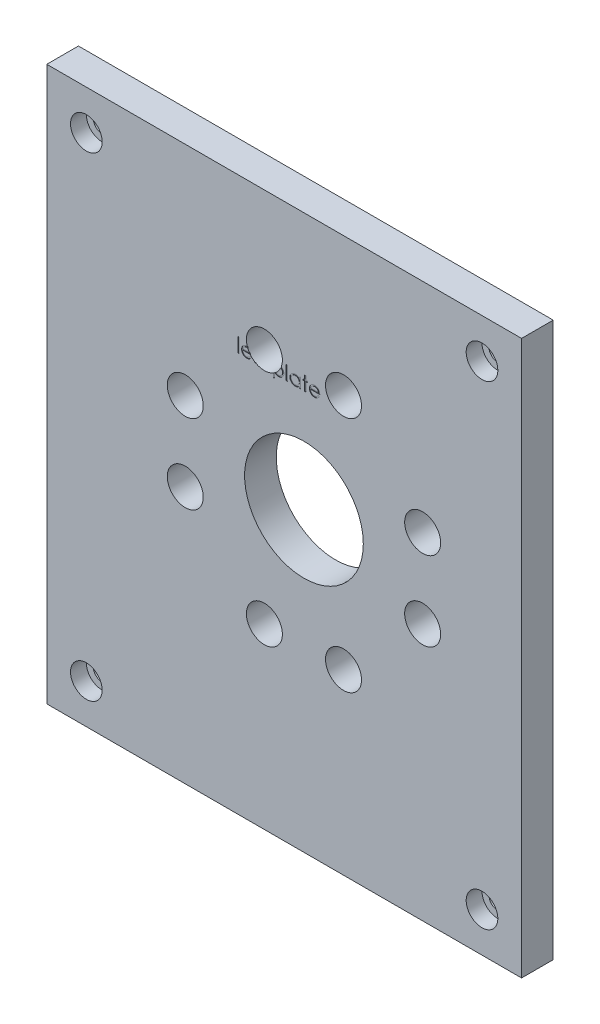
from build123d import *

# Parameters (mm, degrees)
SKETCH_1_W                   = 120
SKETCH_1_H                   = 140
EXTRUDE_1_DEPTH              = 8
HOLE_WIZARD_M4_1_D           = 4.5
HOLE_WIZARD_M4_1_CBORE_D     = 8
HOLE_WIZARD_M4_1_CBORE_DEPTH = 4
SKETCH_4_W                   = 0.314102564
SKETCH_4_H                   = 3.58974359
SKETCH_4_W_2                 = 1.346153846
SKETCH_4_H_2                 = 0.358974359
CUT_EXTRUDE_1_DEPTH          = 0.1
SKETCH_5_R                   = 15
CUT_EXTRUDE_2_DEPTH          = 93.541882551
SKETCH_6_R                   = 4.55
CUT_EXTRUDE_3_DEPTH          = 93.541882551
PATTERN_CIRCULAR_1_COUNT     = 4


with BuildPart() as part:
    # 스케치1 → 보스-돌출1 (new body)
    with BuildSketch(Plane.XY):
        Rectangle(SKETCH_1_W, SKETCH_1_H)
    extrude(amount=EXTRUDE_1_DEPTH)

    # M4 소켓 머리 캡 나사용 카운터보어1 (through all)
    with Locations(Plane.XY.offset(8)):
        with Locations((-50, 60), (50, 60), (50, -60), (-50, -60)):
            CounterBoreHole(HOLE_WIZARD_M4_1_D / 2, HOLE_WIZARD_M4_1_CBORE_D / 2, HOLE_WIZARD_M4_1_CBORE_DEPTH)

    # 스케치4 → 컷-돌출1 (cut)
    # profile 1 of 10: a face of its own
    with BuildSketch(Plane.XY.offset(8)):
        with Locations((-11.532382197, 32.791146705)):
            Rectangle(SKETCH_4_W, SKETCH_4_H)
    # profile 2 of 10: a face of its own
    with BuildSketch(Plane.XY.offset(8)):
        with BuildLine():
            Line((-8.558223543, 31.803967217), (-8.279177069, 31.657432762))
            add(Edge.make_bspline(
                [(-8.279177069, 31.657432762), (-8.301413664, 31.617989431), (-8.344677272, 31.541248328), (-8.41907802, 31.435816468), (-8.497070093, 31.340968752), (-8.582174061, 31.259239098), (-8.67184374, 31.187987713), (-8.766576395, 31.125649888), (-8.866865212, 31.072531368), (-8.972714937, 31.02777884), (-9.085014488, 30.993369346), (-9.204036005, 30.969065125), (-9.3300075, 30.954041856), (-9.41635368, 30.952296715), (-9.460567293, 30.951403115)],
                knots=[0, 0, 0, 0, 1.120438281, 2.179929193, 3.190490725, 4.156257408, 5.095198341, 6.022838206, 6.959905092, 7.901321166, 8.864066838, 9.862729781, 10.905609505, 12, 12, 12, 12], degree=3))
            add(Edge.make_bspline(
                [(-9.460567293, 30.951403115), (-9.509709271, 30.95255029), (-9.605571032, 30.954788097), (-9.745110779, 30.974080561), (-9.876490198, 31.00555292), (-9.999701901, 31.049518462), (-10.114444154, 31.106945786), (-10.220945009, 31.176905267), (-10.319764534, 31.259037522), (-10.407788744, 31.354053966), (-10.487032626, 31.455735923), (-10.556958446, 31.561691807), (-10.615415877, 31.671655032), (-10.662968488, 31.784925556), (-10.701373352, 31.900789449), (-10.728140056, 32.020300917), (-10.743569804, 32.143136501), (-10.74593425, 32.226233837), (-10.747125787, 32.268109846)],
                knots=[0, 0, 0, 0, 1.145258523, 2.234067595, 3.276747158, 4.290159414, 5.277019952, 6.260822364, 7.254936242, 8.264827045, 9.274100331, 10.257902744, 11.220704747, 12.172965371, 13.118907548, 14.062713208, 15.023725156, 16, 16, 16, 16], degree=3))
            add(Edge.make_bspline(
                [(-10.747125787, 32.268109846), (-10.746066645, 32.307404676), (-10.743967567, 32.385281841), (-10.73073678, 32.500547385), (-10.707288487, 32.612575838), (-10.675112163, 32.721460286), (-10.633560917, 32.82701842), (-10.582728697, 32.929314483), (-10.52253632, 33.028239623), (-10.476063646, 33.090642757), (-10.452654633, 33.122076192)],
                knots=[0, 0, 0, 0, 1.024358464, 2.0301432, 3.019427413, 4.004406732, 4.986367066, 5.972626655, 6.978780325, 8, 8, 8, 8], degree=3))
            add(Edge.make_bspline(
                [(-10.452654633, 33.122076192), (-10.42094695, 33.159945062), (-10.358536003, 33.234483212), (-10.252979648, 33.332421538), (-10.138679452, 33.414465313), (-10.017067826, 33.482472449), (-9.886731352, 33.534146096), (-9.749422061, 33.572653679), (-9.603576474, 33.59423169), (-9.503871253, 33.597279523), (-9.452854953, 33.598839012)],
                knots=[0, 0, 0, 0, 1.030682036, 2.02871468, 2.997146059, 3.962720338, 4.930598197, 5.918074684, 6.934738563, 8, 8, 8, 8], degree=3))
            add(Edge.make_bspline(
                [(-9.452854953, 33.598839012), (-9.400407348, 33.597484963), (-9.297517102, 33.594828628), (-9.147484981, 33.570202295), (-9.005524265, 33.53114974), (-8.87169176, 33.47599595), (-8.745973899, 33.404836398), (-8.62918785, 33.316694556), (-8.519336337, 33.214276469), (-8.455427758, 33.13551326), (-8.422907037, 33.095433564)],
                knots=[0, 0, 0, 0, 1.056321875, 2.072262726, 3.055038591, 4.01806755, 4.982017516, 5.957941055, 6.960871419, 8, 8, 8, 8], degree=3))
            add(Edge.make_bspline(
                [(-8.422907037, 33.095433564), (-8.400780098, 33.065229982), (-8.356673505, 33.005023864), (-8.301426405, 32.906852706), (-8.25346901, 32.804142112), (-8.215136049, 32.695231815), (-8.184096548, 32.581412235), (-8.161639729, 32.46186969), (-8.148470111, 32.336639779), (-8.145881413, 32.251313223), (-8.144561684, 32.207813371)],
                knots=[0, 0, 0, 0, 0.94817472, 1.890038105, 2.849395472, 3.817997239, 4.812318967, 5.836947057, 6.897266129, 8, 8, 8, 8], degree=3))
            Line((-8.144561684, 32.207813371), (-10.433023223, 32.207813371))
            add(Edge.make_bspline(
                [(-10.433023223, 32.207813371), (-10.431483616, 32.174112907), (-10.428456042, 32.107842303), (-10.414340899, 32.01087152), (-10.392092125, 31.918498178), (-10.360823063, 31.831415136), (-10.322956217, 31.748485009), (-10.276570501, 31.670322972), (-10.221230947, 31.597285042), (-10.159505247, 31.528717904), (-10.090798152, 31.467657143), (-10.018515405, 31.413005367), (-9.94162184, 31.36719977), (-9.860723756, 31.33001988), (-9.775951971, 31.300913564), (-9.687279776, 31.281045743), (-9.59488166, 31.267738636), (-9.531895926, 31.266258971), (-9.499830114, 31.265505679)],
                knots=[0, 0, 0, 0, 1.094153842, 2.151609401, 3.174256925, 4.172055639, 5.149267565, 6.128595816, 7.11444997, 8.118368179, 9.117203808, 10.09244225, 11.054858984, 12.015122123, 12.976791628, 13.957293641, 14.960065497, 16, 16, 16, 16], degree=3))
            add(Edge.make_bspline(
                [(-9.499830114, 31.265505679), (-9.468478966, 31.266113736), (-9.406272275, 31.267320237), (-9.313631418, 31.279052148), (-9.22249189, 31.298022423), (-9.133230907, 31.323912413), (-9.047660061, 31.355489265), (-8.968414511, 31.393592123), (-8.895534295, 31.43574187), (-8.827417329, 31.483951545), (-8.761346336, 31.542959732), (-8.695803849, 31.616595453), (-8.625527196, 31.703682981), (-8.581537603, 31.769228647), (-8.558223543, 31.803967217)],
                knots=[0, 0, 0, 0, 0.99110716, 1.966546729, 2.947904876, 3.932708344, 4.903319531, 5.828989031, 6.710028674, 7.56322171, 8.463672341, 9.504779593, 10.677557249, 12, 12, 12, 12], degree=3))
        make_face()
        with BuildLine():
            add(Edge.make_bspline(
                [(-8.458664248, 32.521915935), (-8.470160873, 32.563578809), (-8.492288174, 32.64376643), (-8.538524539, 32.75480732), (-8.590596079, 32.853495221), (-8.652217811, 32.939074854), (-8.722036536, 33.015078367), (-8.802681719, 33.081496952), (-8.893117613, 33.140914403), (-8.992876753, 33.191066903), (-9.098518538, 33.233756762), (-9.20912473, 33.262381877), (-9.321982518, 33.28199142), (-9.398316804, 33.283817528), (-9.436729152, 33.284736448)],
                knots=[0, 0, 0, 0, 1.154881502, 2.222775134, 3.210006277, 4.132804581, 5.035138423, 5.962687519, 6.919655026, 7.923214229, 8.944639381, 9.960483929, 10.97369054, 12, 12, 12, 12], degree=3))
            add(Edge.make_bspline(
                [(-9.436729152, 33.284736448), (-9.468078591, 33.284124777), (-9.53004984, 33.282915631), (-9.621350908, 33.271445501), (-9.709030607, 33.252485656), (-9.793735894, 33.2265207), (-9.874356763, 33.191912097), (-9.952551531, 33.151328871), (-10.026331927, 33.101787287), (-10.072473223, 33.064028432), (-10.095783639, 33.044952794)],
                knots=[0, 0, 0, 0, 1.04873581, 2.073130211, 3.073294108, 4.04793562, 5.032784715, 6.005352987, 6.992311501, 8, 8, 8, 8], degree=3))
            add(Edge.make_bspline(
                [(-10.095783639, 33.044952794), (-10.112476921, 33.029858479), (-10.146260055, 32.999311263), (-10.191400577, 32.946682056), (-10.23462105, 32.889930494), (-10.273954702, 32.826885369), (-10.310032289, 32.75826459), (-10.343792266, 32.684646955), (-10.374178678, 32.605473825), (-10.391274788, 32.550301386), (-10.400070498, 32.521915935)],
                knots=[0, 0, 0, 0, 0.879870761, 1.780643979, 2.707998968, 3.669668524, 4.684282772, 5.740141944, 6.837334558, 8, 8, 8, 8], degree=3))
            Line((-10.400070498, 32.521915935), (-8.458664248, 32.521915935))
        make_face(mode=Mode.SUBTRACT)
    # profile 3 of 10: a face of its own
    with BuildSketch(Plane.XY.offset(8)):
        with BuildLine():
            Line((-6.439433479, 34.564984846), (-6.439433479, 34.238262089))
            add(Edge.make_bspline(
                [(-6.439433479, 34.238262089), (-6.469172258, 34.250212962), (-6.525617079, 34.272895965), (-6.608857455, 34.297560591), (-6.685386289, 34.313496331), (-6.734540179, 34.315732275), (-6.757742774, 34.31678773)],
                knots=[0, 0, 0, 0, 1.16548392, 2.212112691, 3.15604595, 4, 4, 4, 4], degree=3))
            add(Edge.make_bspline(
                [(-6.757742774, 34.31678773), (-6.773416538, 34.31613639), (-6.803755717, 34.314875613), (-6.847359044, 34.308447337), (-6.886648254, 34.295344536), (-6.921553874, 34.27831526), (-6.950504334, 34.256961076), (-6.975290558, 34.235505812), (-6.993257088, 34.211320631), (-7.003012036, 34.188800221), (-7.008962036, 34.167949228), (-7.010752165, 34.146594962), (-7.015137079, 34.120370875), (-7.016359885, 34.088207157), (-7.019147254, 34.051104447), (-7.018900613, 34.00827755), (-7.021184536, 33.960400408), (-7.020842621, 33.926499859), (-7.020663447, 33.908734846)],
                knots=[0, 0, 0, 0, 1.311993654, 2.539582093, 3.670788641, 4.763509788, 5.772417512, 6.671800701, 7.496729179, 8.266799162, 8.712543678, 9.304149002, 10.05334463, 10.934920737, 11.99209668, 13.165090968, 14.514413552, 16, 16, 16, 16], degree=3))
            Line((-7.020663447, 33.908734846), (-7.020663447, 33.553967217))
            Line((-7.020663447, 33.553967217), (-6.484305274, 33.553967217))
            Line((-6.484305274, 33.553967217), (-6.484305274, 33.239864653))
            Line((-6.484305274, 33.239864653), (-7.021364569, 33.239864653))
            Line((-7.021364569, 33.239864653), (-7.022766812, 30.99627491))
            Line((-7.022766812, 30.99627491), (-7.336869376, 30.99627491))
            Line((-7.336869376, 30.99627491), (-7.336869376, 33.239864653))
            Line((-7.336869376, 33.239864653), (-7.695843735, 33.239864653))
            Line((-7.695843735, 33.239864653), (-7.695843735, 33.553967217))
            Line((-7.695843735, 33.553967217), (-7.336869376, 33.553967217))
            Line((-7.336869376, 33.553967217), (-7.336869376, 33.962721224))
            add(Edge.make_bspline(
                [(-7.336869376, 33.962721224), (-7.336844162, 33.985396804), (-7.336795791, 34.028897708), (-7.33340794, 34.091507148), (-7.330512219, 34.149330613), (-7.324744591, 34.201919245), (-7.318082886, 34.249765389), (-7.308546726, 34.29215827), (-7.299535355, 34.330240029), (-7.283186763, 34.373342686), (-7.258764544, 34.42219271), (-7.219234347, 34.47381661), (-7.17184134, 34.520121557), (-7.115233016, 34.55912891), (-7.051517481, 34.591544388), (-6.980636303, 34.614786241), (-6.903361105, 34.627926685), (-6.849873635, 34.629880895), (-6.822245979, 34.630890294)],
                knots=[0, 0, 0, 0, 1.116398763, 2.141702935, 3.087165306, 3.966655413, 4.746276475, 5.464069668, 6.106083417, 6.67047701, 7.730773247, 8.782666744, 9.856985883, 10.980834087, 12.154321827, 13.366232824, 14.639591414, 16, 16, 16, 16], degree=3))
            add(Edge.make_bspline(
                [(-6.822245979, 34.630890294), (-6.794169221, 34.629932914), (-6.735223556, 34.627922944), (-6.643026954, 34.615489537), (-6.543430436, 34.594018507), (-6.475094516, 34.574940622), (-6.439433479, 34.564984846)],
                knots=[0, 0, 0, 0, 0.864728408, 1.815451418, 2.859995356, 4, 4, 4, 4], degree=3))
        make_face()
    # profile 4 of 10: a face of its own
    with BuildSketch(Plane.XY.offset(8)):
        Polygon((-5.676612966, 34.5860185), (-5.362510402, 34.5860185), (-5.362510402, 33.553967217), (-4.913792453, 33.553967217), (-4.913792453, 33.239864653), (-5.362510402, 33.239864653), (-5.362510402, 30.99627491), (-5.676612966, 30.99627491), (-5.676612966, 33.239864653), (-6.125330915, 33.239864653), (-6.125330915, 33.553967217), (-5.676612966, 33.553967217), align=None)
    # profile 5 of 10: a face of its own
    with BuildSketch(Plane.XY.offset(8)):
        with Locations((-3.926612966, 32.342428756)):
            Rectangle(SKETCH_4_W_2, SKETCH_4_H_2)
    # profile 6 of 10: a face of its own
    with BuildSketch(Plane.XY.offset(8)):
        with BuildLine():
            Line((-2.7599463, 33.553967217), (-2.445843735, 33.553967217))
            Line((-2.445843735, 33.553967217), (-2.445843735, 33.080710006))
            add(Edge.make_bspline(
                [(-2.445843735, 33.080710006), (-2.412486251, 33.12364774), (-2.347662657, 33.207088633), (-2.235937752, 33.315078761), (-2.118010943, 33.406154065), (-1.99084753, 33.477536598), (-1.85642384, 33.53135741), (-1.715291523, 33.57113686), (-1.566252758, 33.594578334), (-1.464356305, 33.597399995), (-1.41239021, 33.598839012)],
                knots=[0, 0, 0, 0, 1.0828784, 2.104357462, 3.088488658, 4.04616522, 5.001424249, 5.969181776, 6.964304535, 8, 8, 8, 8], degree=3))
            add(Edge.make_bspline(
                [(-1.41239021, 33.598839012), (-1.366998607, 33.597525833), (-1.277279718, 33.594930266), (-1.145216489, 33.577357212), (-1.018041106, 33.547239519), (-0.896473052, 33.503838604), (-0.779209987, 33.450183134), (-0.667987887, 33.382466099), (-0.561074331, 33.304059908), (-0.461158142, 33.213827757), (-0.368836775, 33.11619949), (-0.288990593, 33.011177186), (-0.220118689, 32.9022146), (-0.164448393, 32.787622508), (-0.120840045, 32.668303278), (-0.089825368, 32.543774837), (-0.071367724, 32.414498897), (-0.068891272, 32.326596176), (-0.067638607, 32.282132282)],
                knots=[0, 0, 0, 0, 1.041296284, 2.058176809, 3.050446431, 4.034000596, 5.01514041, 6.003636468, 7.015969324, 8.052561599, 9.08815499, 10.094063707, 11.074456064, 12.040834395, 13.011057502, 13.983766392, 14.980127149, 16, 16, 16, 16], degree=3))
            add(Edge.make_bspline(
                [(-0.067638607, 32.282132282), (-0.068864093, 32.236729973), (-0.071280927, 32.147190069), (-0.090025933, 32.015702971), (-0.119982807, 31.889215597), (-0.16304099, 31.767938334), (-0.218682479, 31.651954683), (-0.286387039, 31.541348287), (-0.366273506, 31.436154583), (-0.457574634, 31.337801683), (-0.55662757, 31.24720237), (-0.662505059, 31.167964301), (-0.773563985, 31.101422926), (-0.889236152, 31.045839966), (-1.010511791, 31.003947782), (-1.136825068, 30.973729981), (-1.268107215, 30.955095486), (-1.357408367, 30.952643343), (-1.402574505, 30.951403115)],
                knots=[0, 0, 0, 0, 1.038740735, 2.04854663, 3.033179607, 4.009277356, 4.987731542, 5.972001279, 6.972200261, 8.005528982, 9.039189865, 10.040446548, 11.026516639, 11.997840187, 12.972163198, 13.956796175, 14.96660207, 16, 16, 16, 16], degree=3))
            add(Edge.make_bspline(
                [(-1.402574505, 30.951403115), (-1.453402077, 30.952697923), (-1.553801433, 30.955255547), (-1.700599103, 30.981174958), (-1.841875955, 31.019911893), (-1.97606678, 31.076610887), (-2.104234592, 31.148866403), (-2.225654398, 31.236976609), (-2.340971151, 31.340757233), (-2.410379908, 31.41948905), (-2.445843735, 31.459716416)],
                knots=[0, 0, 0, 0, 1.014726462, 2.004382257, 2.969841629, 3.936926163, 4.907207904, 5.903978561, 6.929055279, 8, 8, 8, 8], degree=3))
            Line((-2.445843735, 31.459716416), (-2.445843735, 30.053967217))
            Line((-2.445843735, 30.053967217), (-2.7599463, 30.053967217))
            Line((-2.7599463, 30.053967217), (-2.7599463, 33.553967217))
        make_face()
        with BuildLine():
            add(Edge.make_bspline(
                [(-1.415194697, 33.284736448), (-1.450774259, 33.28409619), (-1.520821247, 33.282835687), (-1.623493466, 33.267861738), (-1.722388894, 33.246123997), (-1.816510845, 33.213212096), (-1.906761462, 33.172813283), (-1.992445627, 33.122331272), (-2.073503194, 33.062679266), (-2.149730225, 32.994999922), (-2.218593518, 32.920425234), (-2.279556446, 32.840837425), (-2.330763751, 32.756337285), (-2.373265771, 32.667711923), (-2.405609054, 32.574266638), (-2.428564774, 32.476533625), (-2.442995127, 32.374405913), (-2.444884064, 32.304849906), (-2.445843735, 32.269512089)],
                knots=[0, 0, 0, 0, 1.05670511, 2.080379991, 3.077984906, 4.06214886, 5.038337365, 6.01289324, 7.01187578, 8.025460281, 9.038092164, 10.024533457, 11.000252242, 11.969694649, 12.940728589, 13.933144304, 14.949937299, 16, 16, 16, 16], degree=3))
            add(Edge.make_bspline(
                [(-2.445843735, 32.269512089), (-2.444252879, 32.223123977), (-2.441136257, 32.132245736), (-2.415798889, 31.999461614), (-2.374563625, 31.873809958), (-2.316034912, 31.756348921), (-2.242087338, 31.648366086), (-2.152989181, 31.551675479), (-2.04954663, 31.466884888), (-1.933479438, 31.395463635), (-1.809057308, 31.337475568), (-1.679271396, 31.295961358), (-1.545906515, 31.27038913), (-1.455738195, 31.267142311), (-1.410286844, 31.265505679)],
                knots=[0, 0, 0, 0, 1.03728447, 2.032128127, 3.01272805, 3.987917167, 4.958271349, 5.931593992, 6.91984656, 7.941419022, 8.973179163, 9.983609215, 10.983593296, 12, 12, 12, 12], degree=3))
            add(Edge.make_bspline(
                [(-1.410286844, 31.265505679), (-1.365751076, 31.267062056), (-1.277355583, 31.270151184), (-1.147197462, 31.296889372), (-1.020706824, 31.337734396), (-0.900526651, 31.397293953), (-0.787703163, 31.470284011), (-0.68582161, 31.557844044), (-0.596814696, 31.659333987), (-0.520950341, 31.77234249), (-0.459818856, 31.893517874), (-0.413888616, 32.018899262), (-0.387380043, 32.148044685), (-0.383623254, 32.235042398), (-0.381741171, 32.278626673)],
                knots=[0, 0, 0, 0, 1.00104056, 1.986885549, 2.97790532, 3.984399681, 4.995088187, 5.994304198, 6.996462723, 8.023150851, 9.048424203, 10.043036403, 11.019596776, 12, 12, 12, 12], degree=3))
            add(Edge.make_bspline(
                [(-0.381741171, 32.278626673), (-0.383195905, 32.322481662), (-0.386094039, 32.409849965), (-0.414641077, 32.538612868), (-0.457541054, 32.664500844), (-0.520100106, 32.784021394), (-0.594301376, 32.896795477), (-0.684048373, 32.996349356), (-0.784664569, 33.083520029), (-0.897353733, 33.155535438), (-1.018294159, 33.212820933), (-1.145609075, 33.254704572), (-1.278652677, 33.279878322), (-1.369280331, 33.283102828), (-1.415194697, 33.284736448)],
                knots=[0, 0, 0, 0, 0.983928682, 1.960191568, 2.949917689, 3.96440592, 4.982380491, 5.975291189, 6.965713506, 7.964880129, 8.970154049, 9.96478489, 10.968906225, 12, 12, 12, 12], degree=3))
        make_face(mode=Mode.SUBTRACT)
    # profile 7 of 10: a face of its own
    with BuildSketch(Plane.XY.offset(8)):
        with Locations((0.672746008, 32.791146705)):
            Rectangle(SKETCH_4_W, SKETCH_4_H)
    # profile 8 of 10: a face of its own
    with BuildSketch(Plane.XY.offset(8)):
        with BuildLine():
            Line((4.150310111, 33.553967217), (4.150310111, 30.99627491))
            Line((4.150310111, 30.99627491), (3.836207547, 30.99627491))
            Line((3.836207547, 30.99627491), (3.836207547, 31.438682762))
            add(Edge.make_bspline(
                [(3.836207547, 31.438682762), (3.800788756, 31.398643168), (3.731668541, 31.320505397), (3.616227423, 31.218423225), (3.493859245, 31.134044903), (3.365157924, 31.065894988), (3.23023968, 31.014702931), (3.089403593, 30.978316772), (2.942592212, 30.954922937), (2.842339857, 30.952586915), (2.791536072, 30.951403115)],
                knots=[0, 0, 0, 0, 1.074387032, 2.096679803, 3.090159297, 4.057316773, 5.018401886, 5.985159533, 6.978961417, 8, 8, 8, 8], degree=3))
            add(Edge.make_bspline(
                [(2.791536072, 30.951403115), (2.746368118, 30.952629487), (2.657294914, 30.955047948), (2.526265836, 30.973810251), (2.400173587, 31.003940873), (2.278899014, 31.045841762), (2.163226869, 31.101422584), (2.052166772, 31.167963832), (1.94629408, 31.247204662), (1.847222541, 31.33779269), (1.755990541, 31.436187678), (1.675929268, 31.541133225), (1.609176188, 31.652175528), (1.553356108, 31.767908682), (1.510359763, 31.889223602), (1.480386129, 32.01570077), (1.461645682, 32.147190643), (1.459228222, 32.236730166), (1.458002418, 32.282132282)],
                knots=[0, 0, 0, 0, 1.033919861, 2.038935746, 3.024066025, 3.998881131, 4.97069526, 5.957263378, 6.95902576, 7.993208707, 9.027059324, 10.027763471, 11.009749337, 11.988697705, 12.965288445, 13.950418724, 14.960734635, 16, 16, 16, 16], degree=3))
            add(Edge.make_bspline(
                [(1.458002418, 32.282132282), (1.45925539, 32.326595985), (1.461732447, 32.414498328), (1.480185667, 32.543777026), (1.511216675, 32.668295287), (1.554764523, 32.78765223), (1.610606478, 32.901992281), (1.678534565, 33.011396306), (1.75855369, 33.116165703), (1.850806097, 33.21383693), (1.950740867, 33.304057544), (2.057649598, 33.38246659), (2.168872879, 33.450183438), (2.286135889, 33.503836915), (2.407702994, 33.547246019), (2.53465644, 33.577278987), (2.666468019, 33.594976309), (2.755958511, 33.597539073), (2.801351777, 33.598839012)],
                knots=[0, 0, 0, 0, 1.020392517, 2.01726096, 2.990465484, 3.961182959, 4.928053699, 5.906110375, 6.912531644, 7.948652711, 8.985773172, 9.998621852, 10.987621588, 11.969261332, 12.953316658, 13.946091881, 14.958173133, 16, 16, 16, 16], degree=3))
            add(Edge.make_bspline(
                [(2.801351777, 33.598839012), (2.853551636, 33.597401261), (2.955913096, 33.594581898), (3.105641106, 33.571119171), (3.247285584, 33.531480703), (3.381939936, 33.477563205), (3.509120622, 33.405914476), (3.627623606, 33.315534515), (3.738689089, 33.206993328), (3.803069381, 33.123622884), (3.836207547, 33.080710006)],
                knots=[0, 0, 0, 0, 1.038897134, 2.037228247, 3.008116434, 3.962042015, 4.918381754, 5.904844433, 6.921570401, 8, 8, 8, 8], degree=3))
            Line((3.836207547, 33.080710006), (3.836207547, 33.553967217))
            Line((3.836207547, 33.553967217), (4.150310111, 33.553967217))
        make_face()
        with BuildLine():
            add(Edge.make_bspline(
                [(2.805558508, 33.284736448), (2.75964417, 33.283102811), (2.66901657, 33.279878269), (2.535972568, 33.254704774), (2.408659154, 33.21282018), (2.28771308, 33.155538279), (2.175044863, 33.083509542), (2.074351192, 32.996388159), (1.984808491, 32.896551145), (1.909500227, 32.784449034), (1.84810973, 32.664270943), (1.804942698, 32.538646505), (1.776473451, 32.409841528), (1.77356493, 32.322478842), (1.772104983, 32.278626673)],
                knots=[0, 0, 0, 0, 1.031046209, 2.035121221, 3.029706178, 4.034933723, 5.034054252, 6.02443088, 7.017295772, 8.038157696, 9.050218397, 10.03989886, 11.016116709, 12, 12, 12, 12], degree=3))
            add(Edge.make_bspline(
                [(1.772104983, 32.278626673), (1.773969876, 32.235036565), (1.777692353, 32.14802721), (1.804443047, 32.019046633), (1.849322921, 31.893392591), (1.910564983, 31.772131597), (1.987251608, 31.659547497), (2.076140261, 31.557807374), (2.178090542, 31.470317786), (2.291018049, 31.397080212), (2.411626019, 31.337917692), (2.538459951, 31.296752052), (2.669135589, 31.270174271), (2.757987923, 31.267069795), (2.802754021, 31.265505679)],
                knots=[0, 0, 0, 0, 0.979072187, 1.954306742, 2.945804271, 3.96968567, 4.997920485, 5.998718438, 6.996577872, 8.005894225, 9.015743152, 10.005417472, 10.995077863, 12, 12, 12, 12], degree=3))
            add(Edge.make_bspline(
                [(2.802754021, 31.265505679), (2.848200524, 31.267165643), (2.93858911, 31.270467147), (3.072027818, 31.295748412), (3.201522781, 31.33751721), (3.325310009, 31.395416337), (3.44062614, 31.467173693), (3.544124018, 31.551180784), (3.631639986, 31.648883968), (3.705832596, 31.756260421), (3.764008013, 31.873972417), (3.806384072, 31.999306608), (3.831437978, 32.132267356), (3.834595707, 32.223131283), (3.836207547, 32.269512089)],
                knots=[0, 0, 0, 0, 1.01762866, 2.023962475, 3.030623092, 4.058876274, 5.077231937, 6.066672613, 7.034107872, 8.005628644, 8.981990164, 9.965428785, 10.961468474, 12, 12, 12, 12], degree=3))
            add(Edge.make_bspline(
                [(3.836207547, 32.269512089), (3.83524789, 32.30484992), (3.833358983, 32.374405953), (3.818928413, 32.476533471), (3.795973487, 32.574267197), (3.763627317, 32.667709886), (3.721136032, 32.756344901), (3.669888267, 32.840808661), (3.608982817, 32.920661873), (3.539400121, 32.994804944), (3.463234918, 33.062431406), (3.382640378, 33.122795647), (3.296661631, 33.172384419), (3.206744594, 33.213425691), (3.112733259, 33.246084841), (3.013862639, 33.267872535), (2.911183652, 33.282832856), (2.841137597, 33.284095236), (2.805558508, 33.284736448)],
                knots=[0, 0, 0, 0, 1.050140795, 2.067009409, 3.05949893, 4.030605086, 5.00011959, 5.97591094, 6.962425594, 7.979863591, 8.993523472, 9.986985069, 10.967611495, 11.937549037, 12.921786183, 13.919465291, 14.943216303, 16, 16, 16, 16], degree=3))
        make_face(mode=Mode.SUBTRACT)
    # profile 9 of 10: a face of its own
    with BuildSketch(Plane.XY.offset(8)):
        Polygon((5.182361393, 34.5860185), (5.496463957, 34.5860185), (5.496463957, 33.553967217), (5.945181906, 33.553967217), (5.945181906, 33.239864653), (5.496463957, 33.239864653), (5.496463957, 30.99627491), (5.182361393, 30.99627491), (5.182361393, 33.239864653), (4.733643444, 33.239864653), (4.733643444, 33.553967217), (5.182361393, 33.553967217), align=None)
    # profile 10 of 10: a face of its own
    with BuildSketch(Plane.XY.offset(8)):
        with BuildLine():
            Line((8.582802098, 31.803967217), (8.861848572, 31.657432762))
            add(Edge.make_bspline(
                [(8.861848572, 31.657432762), (8.839611977, 31.617989431), (8.796348369, 31.541248328), (8.721947621, 31.435816468), (8.643955548, 31.340968752), (8.55885158, 31.259239098), (8.469181901, 31.187987713), (8.374449246, 31.125649888), (8.274160429, 31.072531368), (8.168310704, 31.02777884), (8.056011153, 30.993369346), (7.936989636, 30.969065125), (7.811018141, 30.954041856), (7.724671961, 30.952296715), (7.680458348, 30.951403115)],
                knots=[0, 0, 0, 0, 1.120438281, 2.179929193, 3.190490725, 4.156257408, 5.095198341, 6.022838206, 6.959905092, 7.901321166, 8.864066838, 9.862729781, 10.905609505, 12, 12, 12, 12], degree=3))
            add(Edge.make_bspline(
                [(7.680458348, 30.951403115), (7.63131637, 30.95255029), (7.535454609, 30.954788097), (7.395914862, 30.974080561), (7.264535443, 31.00555292), (7.14132374, 31.049518462), (7.026581487, 31.106945786), (6.920080632, 31.176905267), (6.821261107, 31.259037522), (6.733236897, 31.354053966), (6.653993015, 31.455735923), (6.584067195, 31.561691807), (6.525609764, 31.671655032), (6.478057154, 31.784925556), (6.439652289, 31.900789449), (6.412885585, 32.020300917), (6.397455837, 32.143136501), (6.395091391, 32.226233837), (6.393899854, 32.268109846)],
                knots=[0, 0, 0, 0, 1.145258523, 2.234067595, 3.276747158, 4.290159414, 5.277019952, 6.260822364, 7.254936242, 8.264827045, 9.274100331, 10.257902744, 11.220704747, 12.172965371, 13.118907548, 14.062713208, 15.023725156, 16, 16, 16, 16], degree=3))
            add(Edge.make_bspline(
                [(6.393899854, 32.268109846), (6.394958996, 32.307404676), (6.397058074, 32.385281841), (6.410288861, 32.500547385), (6.433737154, 32.612575838), (6.465913478, 32.721460286), (6.507464725, 32.82701842), (6.558296944, 32.929314483), (6.618489322, 33.028239623), (6.664961995, 33.090642757), (6.688371008, 33.122076192)],
                knots=[0, 0, 0, 0, 1.024358464, 2.0301432, 3.019427413, 4.004406732, 4.986367066, 5.972626655, 6.978780325, 8, 8, 8, 8], degree=3))
            add(Edge.make_bspline(
                [(6.688371008, 33.122076192), (6.720078691, 33.159945062), (6.782489638, 33.234483212), (6.888045993, 33.332421538), (7.002346189, 33.414465313), (7.123957815, 33.482472449), (7.254294289, 33.534146096), (7.39160358, 33.572653679), (7.537449167, 33.59423169), (7.637154388, 33.597279523), (7.688170688, 33.598839012)],
                knots=[0, 0, 0, 0, 1.030682036, 2.02871468, 2.997146059, 3.962720338, 4.930598197, 5.918074684, 6.934738563, 8, 8, 8, 8], degree=3))
            add(Edge.make_bspline(
                [(7.688170688, 33.598839012), (7.740618293, 33.597484963), (7.843508539, 33.594828628), (7.99354066, 33.570202295), (8.135501376, 33.53114974), (8.269333881, 33.47599595), (8.395051742, 33.404836398), (8.511837791, 33.316694556), (8.621689304, 33.214276469), (8.685597883, 33.13551326), (8.718118604, 33.095433564)],
                knots=[0, 0, 0, 0, 1.056321875, 2.072262726, 3.055038591, 4.01806755, 4.982017516, 5.957941055, 6.960871419, 8, 8, 8, 8], degree=3))
            add(Edge.make_bspline(
                [(8.718118604, 33.095433564), (8.740245543, 33.065229982), (8.784352136, 33.005023864), (8.839599236, 32.906852706), (8.887556631, 32.804142112), (8.925889592, 32.695231815), (8.956929093, 32.581412235), (8.979385912, 32.46186969), (8.99255553, 32.336639779), (8.995144228, 32.251313223), (8.996463957, 32.207813371)],
                knots=[0, 0, 0, 0, 0.94817472, 1.890038105, 2.849395472, 3.817997239, 4.812318967, 5.836947057, 6.897266129, 8, 8, 8, 8], degree=3))
            Line((8.996463957, 32.207813371), (6.708002418, 32.207813371))
            add(Edge.make_bspline(
                [(6.708002418, 32.207813371), (6.709542025, 32.174112907), (6.712569599, 32.107842303), (6.726684742, 32.01087152), (6.748933516, 31.918498178), (6.780202578, 31.831415136), (6.818069424, 31.748485009), (6.86445514, 31.670322972), (6.919794694, 31.597285042), (6.981520394, 31.528717904), (7.050227489, 31.467657143), (7.122510236, 31.413005367), (7.199403801, 31.36719977), (7.280301885, 31.33001988), (7.36507367, 31.300913564), (7.453745865, 31.281045743), (7.546143981, 31.267738636), (7.609129715, 31.266258971), (7.641195527, 31.265505679)],
                knots=[0, 0, 0, 0, 1.094153842, 2.151609401, 3.174256925, 4.172055639, 5.149267565, 6.128595816, 7.11444997, 8.118368179, 9.117203808, 10.09244225, 11.054858984, 12.015122123, 12.976791628, 13.957293641, 14.960065497, 16, 16, 16, 16], degree=3))
            add(Edge.make_bspline(
                [(7.641195527, 31.265505679), (7.672546675, 31.266113736), (7.734753366, 31.267320237), (7.827394223, 31.279052148), (7.918533751, 31.298022423), (8.007794734, 31.323912413), (8.09336558, 31.355489265), (8.17261113, 31.393592123), (8.245491346, 31.43574187), (8.313608312, 31.483951545), (8.379679306, 31.542959732), (8.445221792, 31.616595453), (8.515498445, 31.703682981), (8.559488038, 31.769228647), (8.582802098, 31.803967217)],
                knots=[0, 0, 0, 0, 0.99110716, 1.966546729, 2.947904876, 3.932708344, 4.903319531, 5.828989031, 6.710028674, 7.56322171, 8.463672341, 9.504779593, 10.677557249, 12, 12, 12, 12], degree=3))
        make_face()
        with BuildLine():
            add(Edge.make_bspline(
                [(8.682361393, 32.521915935), (8.670864768, 32.563578809), (8.648737467, 32.64376643), (8.602501102, 32.75480732), (8.550429562, 32.853495221), (8.48880783, 32.939074854), (8.418989105, 33.015078367), (8.338343922, 33.081496952), (8.247908028, 33.140914403), (8.148148888, 33.191066903), (8.042507103, 33.233756762), (7.931900911, 33.262381877), (7.819043123, 33.28199142), (7.742708837, 33.283817528), (7.704296489, 33.284736448)],
                knots=[0, 0, 0, 0, 1.154881502, 2.222775134, 3.210006277, 4.132804581, 5.035138423, 5.962687519, 6.919655026, 7.923214229, 8.944639381, 9.960483929, 10.97369054, 12, 12, 12, 12], degree=3))
            add(Edge.make_bspline(
                [(7.704296489, 33.284736448), (7.67294705, 33.284124777), (7.610975801, 33.282915631), (7.519674733, 33.271445501), (7.431995034, 33.252485656), (7.347289747, 33.2265207), (7.266668878, 33.191912097), (7.18847411, 33.151328871), (7.114693714, 33.101787287), (7.068552418, 33.064028432), (7.045242002, 33.044952794)],
                knots=[0, 0, 0, 0, 1.04873581, 2.073130211, 3.073294108, 4.04793562, 5.032784715, 6.005352987, 6.992311501, 8, 8, 8, 8], degree=3))
            add(Edge.make_bspline(
                [(7.045242002, 33.044952794), (7.02854872, 33.029858479), (6.994765586, 32.999311263), (6.949625064, 32.946682056), (6.906404591, 32.889930494), (6.867070939, 32.826885369), (6.830993352, 32.75826459), (6.797233375, 32.684646955), (6.766846963, 32.605473825), (6.749750853, 32.550301386), (6.740955143, 32.521915935)],
                knots=[0, 0, 0, 0, 0.879870761, 1.780643979, 2.707998968, 3.669668524, 4.684282772, 5.740141944, 6.837334558, 8, 8, 8, 8], degree=3))
            Line((6.740955143, 32.521915935), (8.682361393, 32.521915935))
        make_face(mode=Mode.SUBTRACT)
    extrude(amount=-CUT_EXTRUDE_1_DEPTH, mode=Mode.SUBTRACT)

    # 스케치5 → 컷-돌출2 (cut, through all)
    with BuildSketch(Plane.XY.offset(8)):
        with Locations((5, 5)):
            Circle(SKETCH_5_R)
    extrude(amount=-CUT_EXTRUDE_2_DEPTH, mode=Mode.SUBTRACT)

    # 스케치6 → 컷-돌출3 (cut, through all)
    with BuildSketch(Plane.XY.offset(8)):
        with Locations((35, 15)):
            Circle(SKETCH_6_R)
        with Locations((35, -5)):
            Circle(SKETCH_6_R)
    cut_extrude_3 = extrude(amount=-CUT_EXTRUDE_3_DEPTH, mode=Mode.SUBTRACT)

    # 원형 패턴1: 컷-돌출3 ×4 about axis
    pattern_circular_1_axis = Axis((5, 5, 0), (0, 0, 1))
    for i in range(1, PATTERN_CIRCULAR_1_COUNT):
        add(cut_extrude_3.rotate(pattern_circular_1_axis, i * 360 / PATTERN_CIRCULAR_1_COUNT), mode=Mode.SUBTRACT)


solid = part.part
